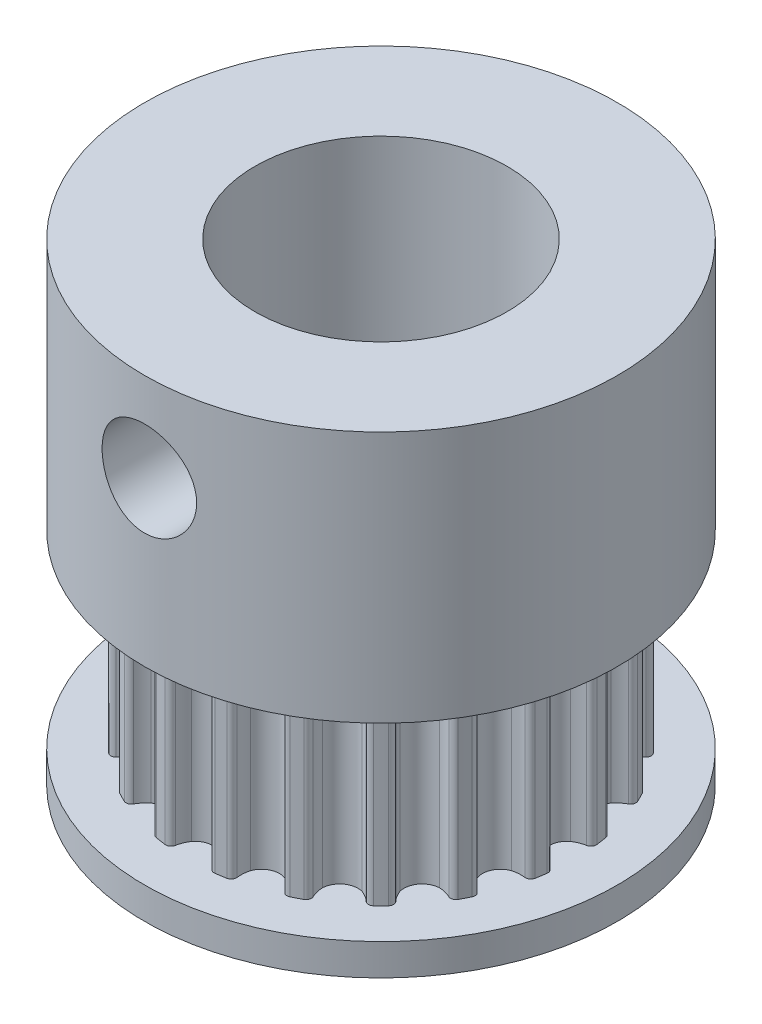
from build123d import *

# Parameters (mm, degrees)
SKETCH1_R                = 6.112203101
BOSS_EXTRUDE1_DEPTH      = 6
CUT_EXTRUDE1_START       = -10
CUT_EXTRUDE1_DEPTH       = 10
FILLET1_R                = 0.17
CIRPATTERN2_COUNT        = 20
FILLET1_OF_CIRPATTERN2_R = 0.17
SKETCH3_R                = 7.5
BOSS_EXTRUDE2_DEPTH      = 8
BOSS_EXTRUDE3_START      = 1
SKETCH4_R                = 7.5
BOSS_EXTRUDE3_DEPTH      = 1
SKETCH6_R                = 4
CUT_EXTRUDE2_DEPTH       = 19.371173153
CUT_EXTRUDE3_REACH       = 23.846
SKETCH7_R                = 1.5


with BuildPart() as part:
    # Sketch1 → Boss-Extrude1 (new body)
    with BuildSketch(Plane(origin=(0, 0, 0), x_dir=(1, 0, 0), z_dir=(0, 1, 0))):
        Circle(SKETCH1_R)
    extrude(amount=BOSS_EXTRUDE1_DEPTH)

    # Sketch2 → Cut-Extrude1 (cut)
    with BuildSketch(Plane(origin=(0, 6, 0), x_dir=(1, 0, 0), z_dir=(0, 1, 0)).offset(CUT_EXTRUDE1_START)):
        with BuildLine():
            ThreePointArc((0.453553699, 5.553771294), (0.572890618, 5.805798391), (0.619514195, 6.080726018))
            ThreePointArc((0.619514195, 6.080726018), (0, 6.112203101), (-0.619514195, 6.080726018))
            ThreePointArc((-0.619514195, 6.080726018), (-0.572890618, 5.805798391), (-0.453553699, 5.553771294))
            ThreePointArc((-0.453553699, 5.553771294), (0, 5.332203101), (0.453553699, 5.553771294))
        make_face()
    cut_extrude1 = extrude(amount=CUT_EXTRUDE1_DEPTH, mode=Mode.SUBTRACT)

    # Fillet1
    fillet1_edges = [part.edges().sort_by_distance(p)[0] for p in [
        (0.619514195, 3, -6.080726018),
        (-0.619514195, 3, -6.080726018),
    ]]
    fillet(fillet1_edges, radius=FILLET1_R)

    # CirPattern2: Cut-Extrude1 ×20 about axis
    cirpattern2_axis = Axis((0, 6, 0), (0, -1, 0))
    for i in range(1, CIRPATTERN2_COUNT):
        add(cut_extrude1.rotate(cirpattern2_axis, i * 360 / CIRPATTERN2_COUNT), mode=Mode.SUBTRACT)

    # Fillet1 of CirPattern2
    fillet1_of_cirpattern2_edges = [part.edges().sort_by_distance(p)[0] for p in [
        (2.46824069, 3, -5.591673689),
        (1.289854666, 3, -5.974554518),
        (4.075358589, 3, -4.55526938),
        (3.072963565, 3, -5.283551994),
        (5.283551994, 3, -3.072963565),
        (4.55526938, 3, -4.075358589),
        (5.974554518, 3, -1.289854666),
        (5.591673689, 3, -2.46824069),
        (6.080726018, 3, 0.619514195),
        (6.080726018, 3, -0.619514195),
        (5.591673689, 3, 2.46824069),
        (5.974554518, 3, 1.289854666),
        (4.55526938, 3, 4.075358589),
        (5.283551994, 3, 3.072963565),
        (3.072963565, 3, 5.283551994),
        (4.075358589, 3, 4.55526938),
        (1.289854666, 3, 5.974554518),
        (2.46824069, 3, 5.591673689),
        (-0.619514195, 3, 6.080726018),
        (0.619514195, 3, 6.080726018),
        (-2.46824069, 3, 5.591673689),
        (-1.289854666, 3, 5.974554518),
        (-4.075358589, 3, 4.55526938),
        (-3.072963565, 3, 5.283551994),
        (-5.283551994, 3, 3.072963565),
        (-4.55526938, 3, 4.075358589),
        (-5.974554518, 3, 1.289854666),
        (-5.591673689, 3, 2.46824069),
        (-6.080726018, 3, -0.619514195),
        (-6.080726018, 3, 0.619514195),
        (-5.591673689, 3, -2.46824069),
        (-5.974554518, 3, -1.289854666),
        (-4.55526938, 3, -4.075358589),
        (-5.283551994, 3, -3.072963565),
        (-3.072963565, 3, -5.283551994),
        (-4.075358589, 3, -4.55526938),
        (-1.289854666, 3, -5.974554518),
        (-2.46824069, 3, -5.591673689),
    ]]
    fillet(fillet1_of_cirpattern2_edges, radius=FILLET1_OF_CIRPATTERN2_R)

    # Sketch3 → Boss-Extrude2 (add)
    with BuildSketch(Plane(origin=(0, 6, 0), x_dir=(1, 0, 0), z_dir=(0, 1, 0))):
        Circle(SKETCH3_R)
    extrude(amount=BOSS_EXTRUDE2_DEPTH)

    # Sketch4 → Boss-Extrude3 (add)
    with BuildSketch(Plane.XZ.offset(BOSS_EXTRUDE3_START)):
        Circle(SKETCH4_R)
    extrude(amount=-BOSS_EXTRUDE3_DEPTH)

    # Sketch6 → Cut-Extrude2 (cut, through all)
    with BuildSketch(Plane(origin=(0, 14, 0), x_dir=(1, 0, 0), z_dir=(0, 1, 0))):
        Circle(SKETCH6_R)
    extrude(amount=-CUT_EXTRUDE2_DEPTH, mode=Mode.SUBTRACT)

    # Sketch7 → Cut-Extrude3 (cut, up to next)
    with BuildSketch(Plane.XY.offset(7.5), mode=Mode.PRIVATE) as cut_extrude3_sk1:
        with Locations((0, 11.169295652)):
            Circle(SKETCH7_R)
    cut_extrude3_tool1 = extrude(cut_extrude3_sk1.sketch, amount=-CUT_EXTRUDE3_REACH, mode=Mode.PRIVATE) & part.part
    add(cut_extrude3_tool1.solids().sort_by_distance((0, 11.169296, 7.5))[0], mode=Mode.SUBTRACT)


solid = part.part
